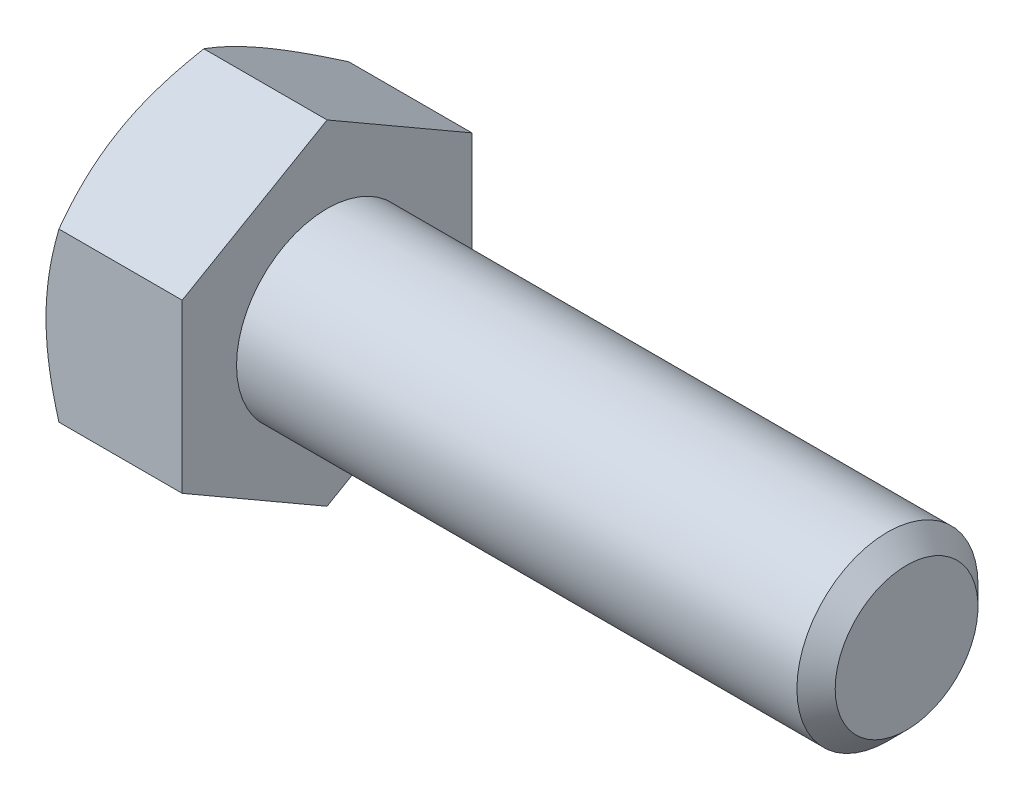
from build123d import *

# Parameters (mm, degrees)
BASEHEAD_DEPTH = 5.969


with BuildPart() as part:
    # Sketch1 → BaseHead (new body)
    with BuildSketch(Plane(origin=(0, 0, 0), x_dir=(0, 0, -1), z_dir=(1, 0, 0))):
        Polygon((6.35, 3.666174209), (6.35, -3.666174209), (0, -7.332348419), (-6.35, -3.666174209), (-6.35, 3.666174209), (0, 7.332348419), align=None)
    extrude(amount=BASEHEAD_DEPTH)

    # BodySke → BaseBody (revolve)
    with BuildSketch(Plane.XY, mode=Mode.PRIVATE) as basebody_sk:
        Polygon((0, 0), (31.369, 0), (31.369, 3.12928), (30.52953, 3.96875), (0, 3.96875), align=None)
    revolve(basebody_sk.sketch.rotate(Axis((0, 0, 0), (1, 0, 0)), 90), axis=Axis((0, 0, 0), (1, 0, 0)))

    # Sketch3 → HeadChamfer (revolve, cut)
    with BuildSketch(Plane.XY):
        Polygon((0, 6.35), (4.233333333, 13.682348419), (4.233333333, 20.032348419), (-12.7, 20.032348419), (-12.7, 6.35), align=None)
    revolve(axis=Axis((0, 0, 0), (1, 0, 0)), mode=Mode.SUBTRACT)


solid = part.part
